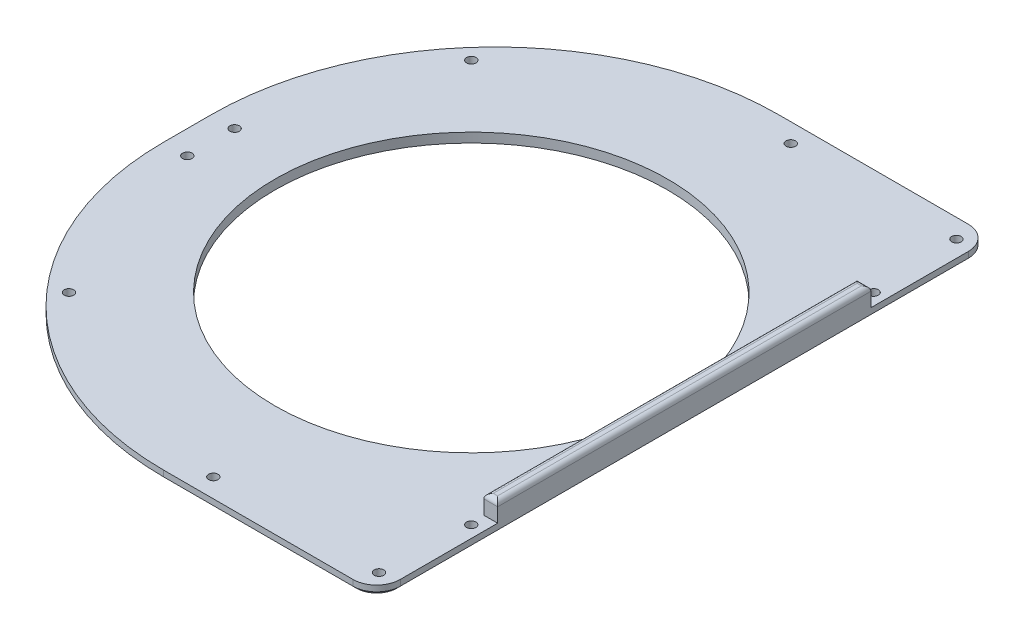
from build123d import *

# Parameters (mm, degrees)
SKETCH_1_W          = 240
SKETCH_1_H          = 260
EXTRUDE_1_DEPTH     = 4
SKETCH_2_R          = 2
CUT_EXTRUDE_1_DEPTH = 177.963273026
SKETCH_3_W          = 30
SKETCH_3_H          = 260
CUT_EXTRUDE_2_DEPTH = 6
FILLET_2_R          = 10
FILLET_3_R          = 120
SKETCH_4_R          = 83
CUT_EXTRUDE_3_DEPTH = 6
SKETCH_5_W          = 5.842752146
SKETCH_5_H          = 157.729812976
EXTRUDE_2_DEPTH     = 8
FILLET_4_R          = 2
CHAMFER_1_SIZE      = 1.5


with BuildPart() as part:
    # Эскиз1 → Бобышка-Вытянуть1 (new body)
    with BuildSketch(Plane(origin=(0, 0, 0), x_dir=(1, 0, 0), z_dir=(0, 1, 0))):
        Rectangle(SKETCH_1_W, SKETCH_1_H)
    extrude(amount=EXTRUDE_1_DEPTH)

    # Эскиз2 → Вырез-Вытянуть1 (cut, through all)
    with BuildSketch(Plane(origin=(0, 4, 0), x_dir=(1, 0, 0), z_dir=(0, 1, 0))):
        with Locations(Location((83, 122, 0), (0, 0, 270))):
            Circle(SKETCH_2_R)
        with Locations(Location((13, 122, 0), (0, 0, 270))):
            Circle(SKETCH_2_R)
        with Locations(Location((83, -122, 0), (0, 0, 90))):
            Circle(SKETCH_2_R)
        with Locations(Location((13, -122, 0), (0, 0, 90))):
            Circle(SKETCH_2_R)
        with Locations(Location((-110, 10, 0), (0, 0, 270))):
            Circle(SKETCH_2_R)
        with Locations(Location((-110, -10, 0), (0, 0, 270))):
            Circle(SKETCH_2_R)
        with Locations(Location((-85, 85, 0), (0, 0, 270))):
            Circle(SKETCH_2_R)
        with Locations(Location((85, 85, 0), (0, 0, 270))):
            Circle(SKETCH_2_R)
        with Locations(Location((-85, -85, 0), (0, 0, 270))):
            Circle(SKETCH_2_R)
        with Locations(Location((85, -85, 0), (0, 0, 270))):
            Circle(SKETCH_2_R)
    extrude(amount=-CUT_EXTRUDE_1_DEPTH, mode=Mode.SUBTRACT)

    # Эскиз3 → Вырез-Вытянуть2 (cut)
    with BuildSketch(Plane(origin=(0, 4, 0), x_dir=(1, 0, 0), z_dir=(0, 1, 0))):
        with Locations((105, 0)):
            Rectangle(SKETCH_3_W, SKETCH_3_H)
    extrude(amount=-CUT_EXTRUDE_2_DEPTH, mode=Mode.SUBTRACT)

    # Скругление2
    fillet_2_edges = [part.edges().sort_by_distance(p)[0] for p in [
        (90, 2, 130),
        (90, 2, -130),
    ]]
    fillet(fillet_2_edges, radius=FILLET_2_R)

    # Скругление3
    fillet_3_edges = [part.edges().sort_by_distance(p)[0] for p in [
        (-120, 2, 130),
        (-120, 2, -130),
    ]]
    fillet(fillet_3_edges, radius=FILLET_3_R)

    # Эскиз4 → Вырез-Вытянуть3 (cut)
    with BuildSketch(Plane(origin=(0, 4, 0), x_dir=(1, 0, 0), z_dir=(0, 1, 0))):
        with Locations(Location((0, 0, 0), (0, 0, 270))):
            Circle(SKETCH_4_R)
    extrude(amount=-CUT_EXTRUDE_3_DEPTH, mode=Mode.SUBTRACT)

    # Эскиз5 → Бобышка-Вытянуть2 (add)
    with BuildSketch(Plane(origin=(0, 4, 0), x_dir=(1, 0, 0), z_dir=(0, 1, 0))):
        with Locations((87.078623927, 0)):
            Rectangle(SKETCH_5_W, SKETCH_5_H)
    extrude(amount=EXTRUDE_2_DEPTH)

    # Скругление4
    fillet_4_edges = [part.edges().sort_by_distance(p)[0] for p in [
        (90, 12, 0),
        (87.078623927, 12, -78.864906488),
        (84.157247854, 12, 0),
        (87.078623927, 12, 78.864906488),
    ]]
    fillet(fillet_4_edges, radius=FILLET_4_R)

    # Фаска1
    chamfer_1_edges = [part.edges().sort_by_distance(p)[0] for p in [
        (90, 0, 0),
        (40, 0, -130),
        (87.071067812, 0, 127.071067812),
        (87.071067812, 0, -127.071067812),
        (-120, 0, 0),
        (40, 0, 130),
        (-84.852813742, 0, 94.852813742),
        (-84.852813742, 0, -94.852813742),
    ]]
    chamfer(chamfer_1_edges, length=CHAMFER_1_SIZE)


solid = part.part
